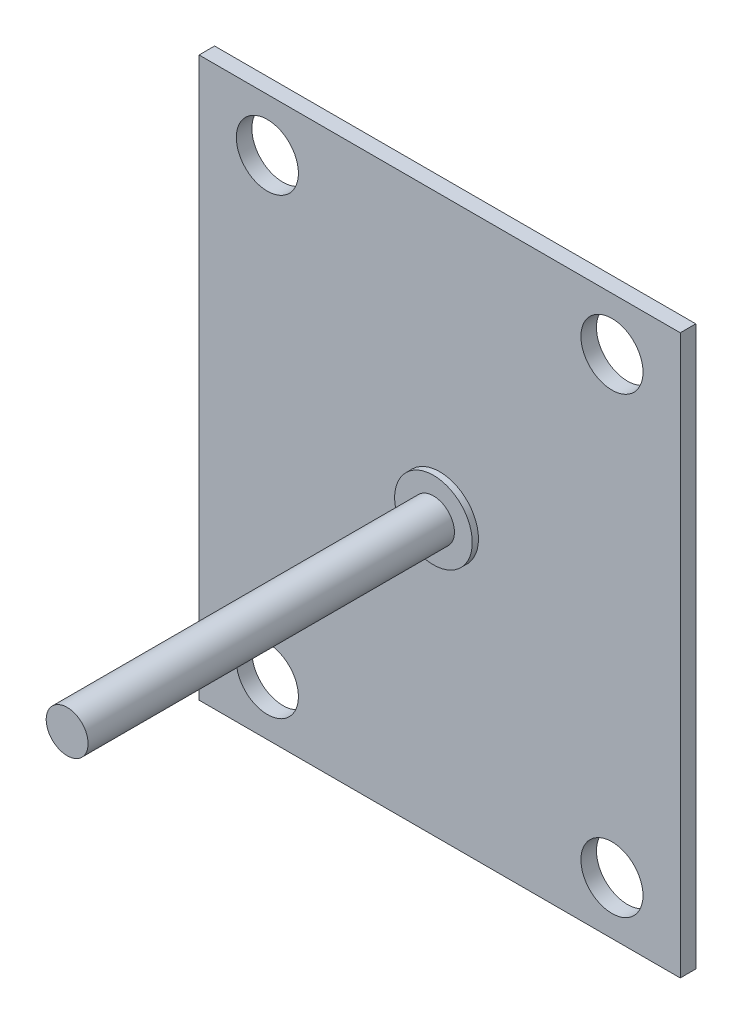
from build123d import *

# Parameters (mm, degrees)
SKETCH1_W           = 155
SKETCH1_H           = 180
SKETCH1_R           = 10
SKETCH1_R_2         = 12.5
BOSS_EXTRUDE1_DEPTH = 5
SKETCH1_3_R         = 12.5
SKETCH1_3_R_2       = 6.75
BOSS_EXTRUDE2_DEPTH = 7
SKETCH1_4_R         = 6.75
BOSS_EXTRUDE3_DEPTH = 125
SKETCH1_5_R         = 5.75
CUT_EXTRUDE1_DEPTH  = 120
SKETCH2_W           = 6
SKETCH2_H           = 3.022470888
CUT_EXTRUDE2_DEPTH  = 80


with BuildPart() as part:
    # Sketch1 → Boss-Extrude1 (new body)
    with BuildSketch(Plane.XY):
        Rectangle(SKETCH1_W, SKETCH1_H)
        with Locations((-55.5, -73)):
            Circle(SKETCH1_R, mode=Mode.SUBTRACT)
        with Locations((55.5, -73)):
            Circle(SKETCH1_R, mode=Mode.SUBTRACT)
        Circle(SKETCH1_R_2, mode=Mode.SUBTRACT)
        with Locations((-55.5, 73)):
            Circle(SKETCH1_R, mode=Mode.SUBTRACT)
        with Locations((55.5, 73)):
            Circle(SKETCH1_R, mode=Mode.SUBTRACT)
    extrude(amount=BOSS_EXTRUDE1_DEPTH)

    # Sketch1<3> → Boss-Extrude2 (add)
    with BuildSketch(Plane.XY):
        Circle(SKETCH1_3_R)
        Circle(SKETCH1_3_R_2, mode=Mode.SUBTRACT)
    extrude(amount=BOSS_EXTRUDE2_DEPTH)

    # Sketch1<4> → Boss-Extrude3 (add)
    with BuildSketch(Plane.XY):
        Circle(SKETCH1_4_R)
    extrude(amount=BOSS_EXTRUDE3_DEPTH)

    # Sketch1<5> → Cut-Extrude1 (cut)
    with BuildSketch(Plane.XY):
        Circle(SKETCH1_5_R)
    extrude(amount=CUT_EXTRUDE1_DEPTH, mode=Mode.SUBTRACT)

    # Sketch2 → Cut-Extrude2 (cut)
    with BuildSketch(Plane.XY.offset(15)):
        with Locations((0, -6.75)):
            Rectangle(SKETCH2_W, SKETCH2_H)
    extrude(amount=CUT_EXTRUDE2_DEPTH, mode=Mode.SUBTRACT)


solid = part.part
